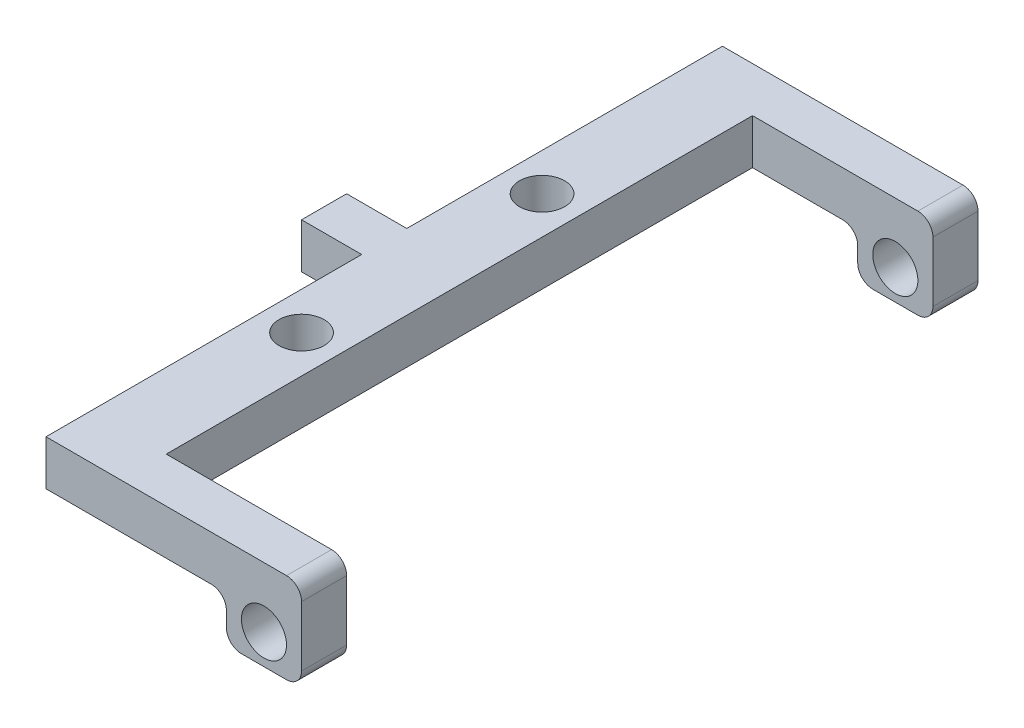
from build123d import *

# Parameters (mm, degrees)
SKETCH_1_R      = 1.5
EXTRUDE_1_DEPTH = 3
SKETCH_3_W      = 5
SKETCH_3_H      = 12
EXTRUDE_2_DEPTH = 3
SKETCH_4_R      = 1.5
EXTRUDE_3_DEPTH = 3


with BuildPart() as part:
    # 草图1 → 凸台-拉伸1 (new body)
    with BuildSketch(Plane(origin=(0, 0, 0), x_dir=(1, 0, 0), z_dir=(0, 1, 0))):
        Polygon((-2.5, -1.5), (-2.5, -10.5), (2.5, -10.5), (2.5, 10.5), (-2.5, 10.5), (-2.5, 1.5), (-6.5, 1.5), (-6.5, -1.5), align=None)
        with Locations(Location((0, 8, 0), (0, 0, 270))):
            Circle(SKETCH_1_R, mode=Mode.SUBTRACT)
        with Locations(Location((0, -8, 0), (0, 0, 270))):
            Circle(SKETCH_1_R, mode=Mode.SUBTRACT)
    extrude(amount=EXTRUDE_1_DEPTH)

    # 草图3 → 凸台-拉伸2 (add)
    with BuildSketch(Plane(origin=(0, 3, 0), x_dir=(1, 0, 0), z_dir=(0, 1, 0))):
        with Locations((0, 16.5)):
            Rectangle(SKETCH_3_W, SKETCH_3_H)
        with Locations((0, -16.5)):
            Rectangle(SKETCH_3_W, SKETCH_3_H)
    extrude(amount=-EXTRUDE_2_DEPTH)

    # 草图4 → 凸台-拉伸3 (add)
    with BuildSketch(Plane(origin=(0, 0, -22.5), x_dir=(-1, 0, 0), z_dir=(0, 0, -1))):
        with BuildLine():
            Line((-2.5, 3), (-13.5, 3))
            ThreePointArc((-13.5, 3), (-14.207106781, 2.707106781), (-14.5, 2))
            Line((-14.5, 2), (-14.5, -2))
            ThreePointArc((-14.5, -2), (-14.207106781, -2.707106781), (-13.5, -3))
            Line((-13.5, -3), (-10.5, -3))
            ThreePointArc((-10.5, -3), (-9.792893219, -2.707106781), (-9.5, -2))
            Line((-9.5, -2), (-9.5, -1))
            ThreePointArc((-9.5, -1), (-9.207106781, -0.292893219), (-8.5, 0))
            Line((-8.5, 0), (-2.5, 0))
            Line((-2.5, 0), (-2.5, 3))
        make_face()
        with Locations((-12, -1)):
            Circle(SKETCH_4_R, mode=Mode.SUBTRACT)
    extrude_3 = extrude(amount=-EXTRUDE_3_DEPTH)

    # 镜向1: 凸台-拉伸3 across plane
    add(extrude_3.mirror(Plane.XY))


solid = part.part
